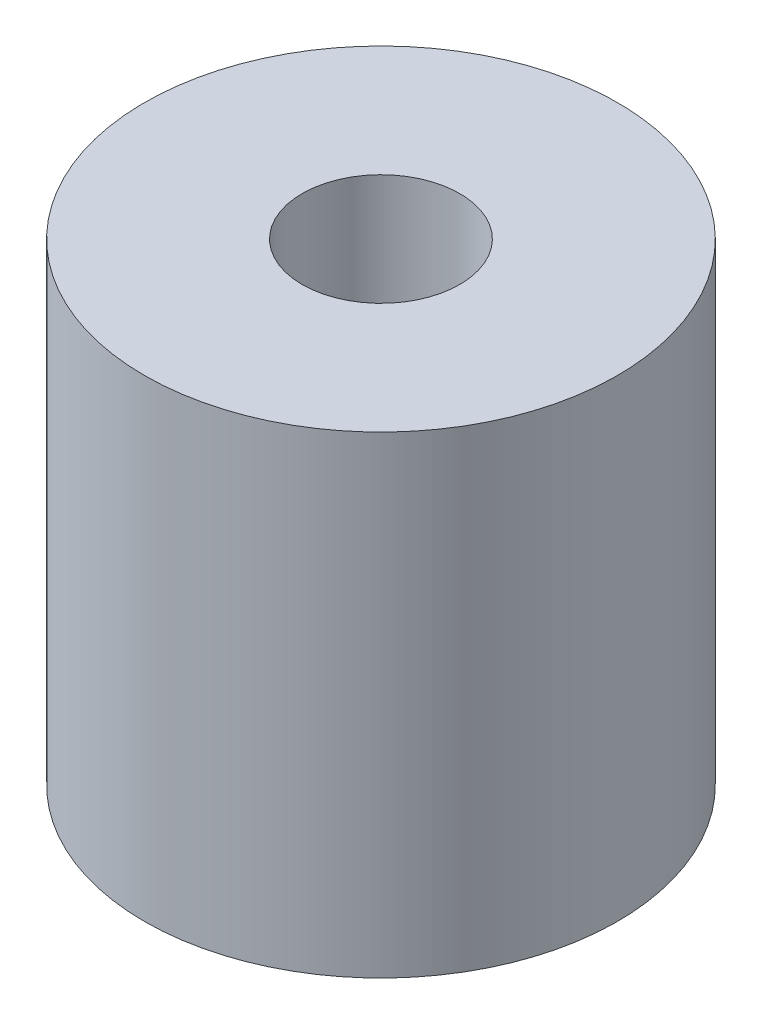
from build123d import *

# Parameters (mm, degrees)
SKETCH1_R           = 4.5
SKETCH1_R_2         = 1.5
BOSS_EXTRUDE1_DEPTH = 9


with BuildPart() as part:
    # Sketch1 → Boss-Extrude1 (new body)
    with BuildSketch(Plane(origin=(0, 0, 0), x_dir=(1, 0, 0), z_dir=(0, 1, 0))):
        with Locations(Location((0, 0, 0), (0, 0, 270))):
            Circle(SKETCH1_R)
        with Locations(Location((0, 0, 0), (0, 0, 270))):
            Circle(SKETCH1_R_2, mode=Mode.SUBTRACT)
    extrude(amount=BOSS_EXTRUDE1_DEPTH)


solid = part.part
